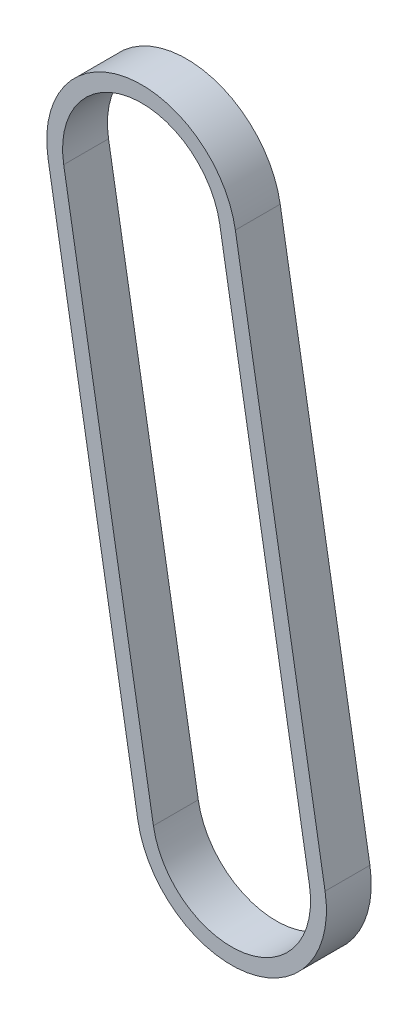
from build123d import *

# Parameters (mm, degrees)
EXTRUDE_1_DEPTH = 8.5


with BuildPart() as part:
    # 草图1 → 凸台-拉伸1 (new body)
    with BuildSketch(Plane.XY):
        with BuildLine():
            Line((-34.74540524, 59.573647069), (-17.74540524, -40.426352931))
            ThreePointArc((-17.74540524, -40.426352931), (3.016718891, -55.155039281), (17.74540524, -34.39291515))
            Line((17.74540524, -34.39291515), (0.74540524, 65.60708485))
            ThreePointArc((0.74540524, 65.60708485), (-20.016718891, 80.335771199), (-34.74540524, 59.573647069))
        make_face()
        with BuildLine():
            Line((-2.2121623, 65.104298368), (14.7878377, -34.895701632))
            ThreePointArc((14.7878377, -34.895701632), (2.513932409, -52.197471741), (-14.7878377, -39.92356645))
            Line((-14.7878377, -39.92356645), (-31.7878377, 60.07643355))
            ThreePointArc((-31.7878377, 60.07643355), (-19.513932409, 77.378203659), (-2.2121623, 65.104298368))
        make_face(mode=Mode.SUBTRACT)
    extrude(amount=EXTRUDE_1_DEPTH)


solid = part.part
